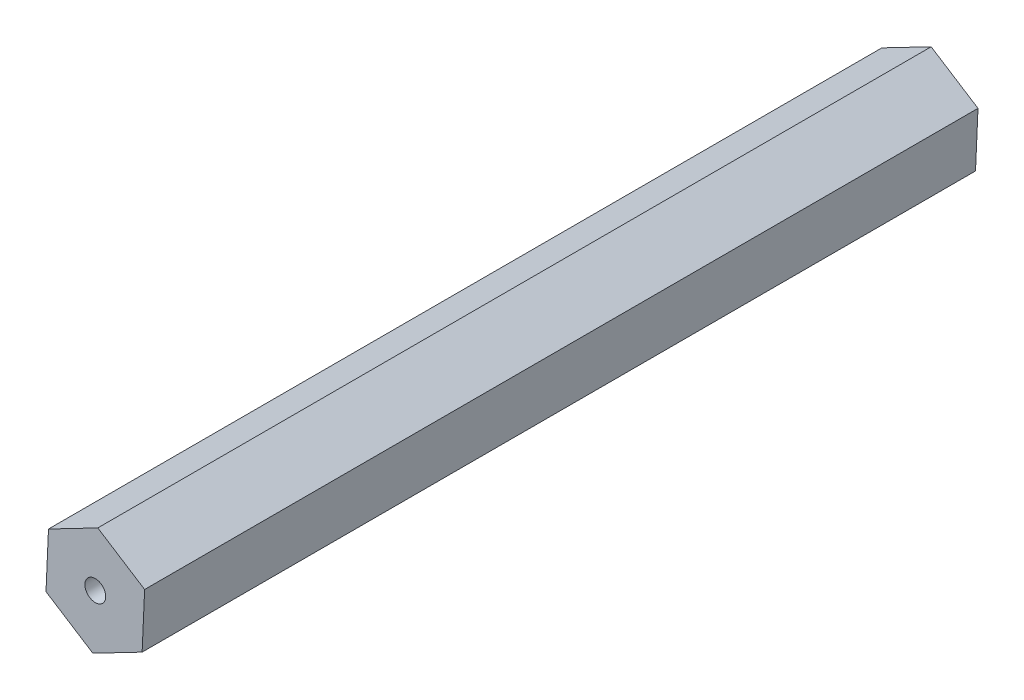
from build123d import *

# Parameters (mm, degrees)
BOSS_EXTRUDE1_DEPTH = 60
SKETCH2_R           = 0.75
CUT_EXTRUDE1_DEPTH  = 5
CUT_EXTRUDE2_START  = -5
SKETCH3_R           = 0.75
CUT_EXTRUDE2_DEPTH  = 5


with BuildPart() as part:
    # Sketch1 → Boss-Extrude1 (new body)
    with BuildSketch(Plane.XY):
        Polygon((3.371246776, -2.152834219), (3.550032512, 1.843168241), (0.178785735, 3.99600246), (-3.371246776, 2.152834219), (-3.550032512, -1.843168241), (-0.178785735, -3.99600246), align=None)
    extrude(amount=BOSS_EXTRUDE1_DEPTH)

    # Sketch2 → Cut-Extrude1 (cut)
    with BuildSketch(Plane.XY.offset(60)):
        Circle(SKETCH2_R)
    extrude(amount=-CUT_EXTRUDE1_DEPTH, mode=Mode.SUBTRACT)

    # Sketch3 → Cut-Extrude2 (cut)
    with BuildSketch(Plane(origin=(0, 0, 0), x_dir=(-1, 0, 0), z_dir=(0, 0, -1)).offset(CUT_EXTRUDE2_START)):
        with Locations(Location((0, 0, 0), (0, 0, 180))):
            Circle(SKETCH3_R)
    extrude(amount=CUT_EXTRUDE2_DEPTH, mode=Mode.SUBTRACT)


solid = part.part
